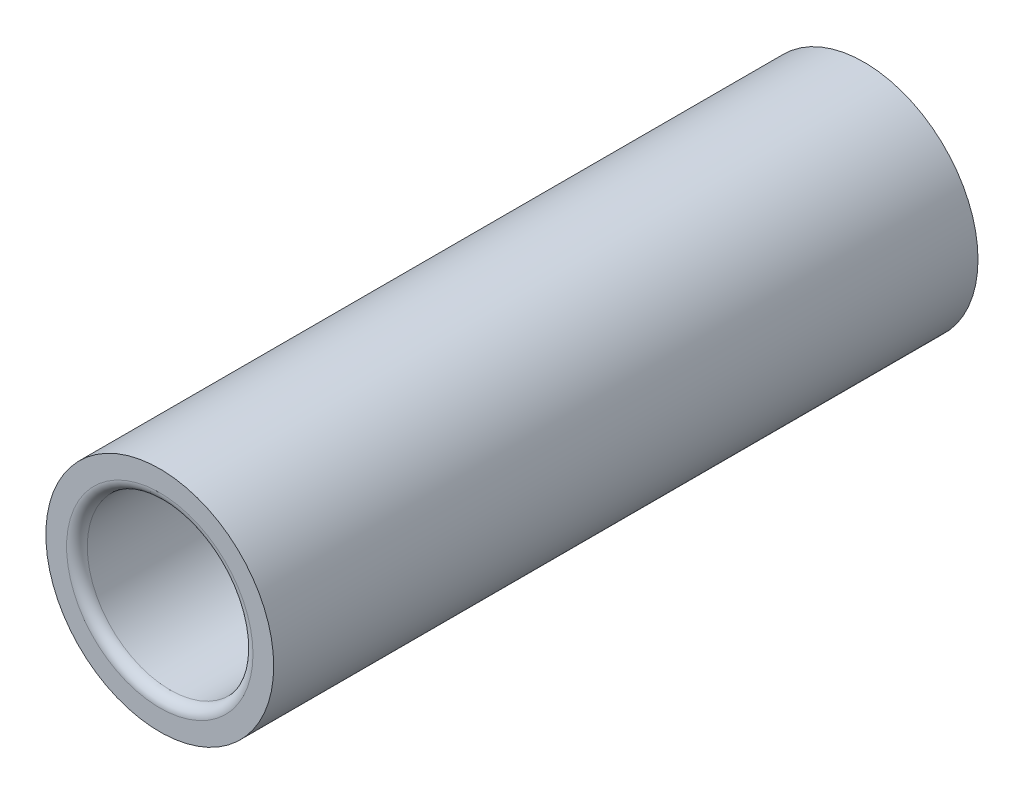
from build123d import *

# Parameters (mm, degrees)
SKETCH1_R           = 11
SKETCH1_R_2         = 8
BOSS_EXTRUDE1_DEPTH = 34
FILLET1_R           = 1


with BuildPart() as part:
    # Sketch1 → Boss-Extrude1 (new, symmetric)
    with BuildSketch(Plane.XY):
        Circle(SKETCH1_R)
        Circle(SKETCH1_R_2, mode=Mode.SUBTRACT)
    extrude(amount=BOSS_EXTRUDE1_DEPTH, both=True)

    # Fillet1
    fillet1_edges = [part.edges().sort_by_distance(p)[0] for p in [
        (-8, 0, -34),
        (-8, 0, 34),
    ]]
    fillet(fillet1_edges, radius=FILLET1_R)


solid = part.part
